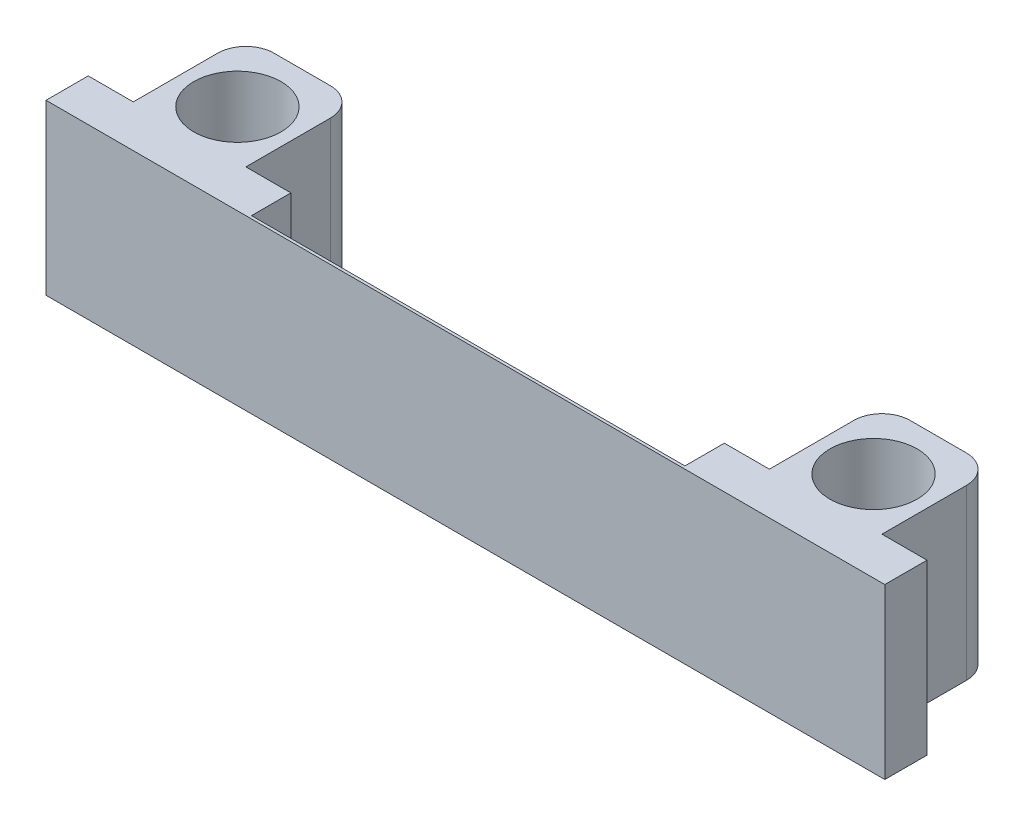
from build123d import *

# Parameters (mm, degrees)
BOSS_EXTRUDE1_DEPTH = 30
SKETCH3_R           = 7.75
CUT_EXTRUDE1_DEPTH  = 30
FILLET1_R           = 5
SKETCH4_W           = 36
SKETCH4_H           = 30
BOSS_EXTRUDE2_DEPTH = 4
SKETCH9_W           = 149
SKETCH9_H           = 30
BOSS_EXTRUDE5_DEPTH = 0.5


with BuildPart() as part:
    # Sketch2 → Boss-Extrude1 (new body)
    with BuildSketch(Plane(origin=(0, 0, 0), x_dir=(1, 0, 0), z_dir=(0, 1, 0))):
        Polygon((-14.863905325, 0), (-6.863905325, 0), (-6.863905325, 20), (13.136094675, 20), (13.136094675, 0), (21.136094675, 0), (21.136094675, -3), (-14.863905325, -3), align=None)
    extrude(amount=BOSS_EXTRUDE1_DEPTH)

    # Sketch3 → Cut-Extrude1 (cut)
    with BuildSketch(Plane.XZ):
        with Locations(Location((3.136094675, -8.5, 0), (0, 0, 270))):
            Circle(SKETCH3_R)
    extrude(amount=-CUT_EXTRUDE1_DEPTH, mode=Mode.SUBTRACT)

    # Fillet1
    fillet1_edges = [part.edges().sort_by_distance(p)[0] for p in [
        (-6.863905325, 15, -20),
        (13.136094675, 15, -20),
    ]]
    fillet(fillet1_edges, radius=FILLET1_R)

    # Sketch4 → Boss-Extrude2 (add)
    with BuildSketch(Plane.XY.offset(3)):
        with Locations((3.136094675, 15)):
            Rectangle(SKETCH4_W, SKETCH4_H)
    extrude(amount=BOSS_EXTRUDE2_DEPTH)


with BuildPart() as body_2:
    # Body-Move/Copy2: copy of part
    add(part.part.moved(Location((113, 0, 0))))


with BuildPart() as part_1:
    add(part.part)

    add(body_2.part)  # Boss-Extrude5 merges body 2
    # Sketch9 → Boss-Extrude5 (add)
    with BuildSketch(Plane.XY.offset(7)):
        with Locations((59.636094675, 15)):
            Rectangle(SKETCH9_W, SKETCH9_H)
    extrude(amount=BOSS_EXTRUDE5_DEPTH)


solid = part_1.part
